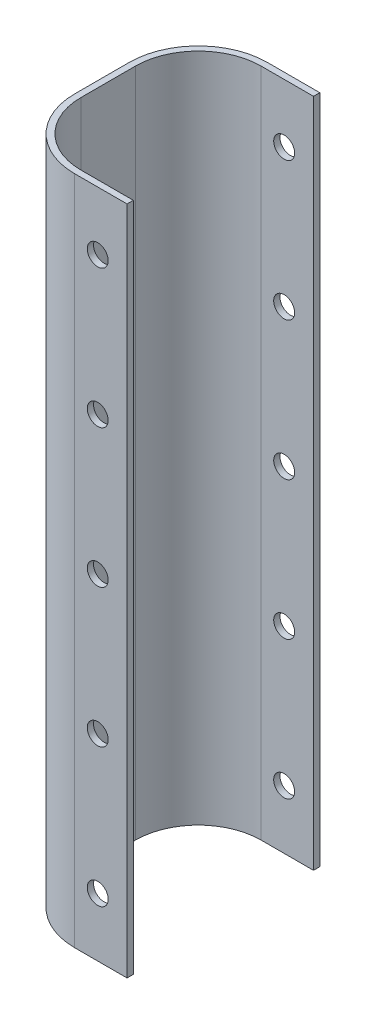
from build123d import *

# Parameters (mm, degrees)
EXTRUDE_2_DEPTH     = 160
SKETCH_5_R          = 2.5
CUT_EXTRUDE_1_DEPTH = 169.988165266


with BuildPart() as part:
    # Эскиз4 → Бобышка-Вытянуть2 (new body)
    with BuildSketch(Plane(origin=(0, 0, 0), x_dir=(1, 0, 0), z_dir=(0, 1, 0))):
        with BuildLine():
            Line((0, 0), (-12.5, 0))
            ThreePointArc((-12.5, 0), (-23.106601718, -4.393398282), (-27.5, -15))
            Line((-27.5, -15), (-27.5, -28))
            ThreePointArc((-27.5, -28), (-23.106601718, -38.606601718), (-12.5, -43))
            Line((-12.5, -43), (0, -43))
            Line((0, -43), (0, -44.5))
            Line((0, -44.5), (-12.5, -44.5))
            ThreePointArc((-12.5, -44.5), (-24.16726189, -39.66726189), (-29, -28))
            Line((-29, -28), (-29, -15))
            ThreePointArc((-29, -15), (-24.16726189, -3.33273811), (-12.5, 1.5))
            Line((-12.5, 1.5), (0, 1.5))
            Line((0, 1.5), (0, 0))
        make_face()
    extrude(amount=EXTRUDE_2_DEPTH)

    # Эскиз5 → Вырез-Вытянуть1 (cut, through all)
    with BuildSketch(Plane.XY.offset(44.5)):
        with Locations((-7, 80)):
            Circle(SKETCH_5_R)
        with Locations((-7, 47)):
            Circle(SKETCH_5_R)
        with Locations((-7, 14)):
            Circle(SKETCH_5_R)
        with Locations((-7, 146)):
            Circle(SKETCH_5_R)
        with Locations((-7, 113)):
            Circle(SKETCH_5_R)
    extrude(amount=-CUT_EXTRUDE_1_DEPTH, mode=Mode.SUBTRACT)


solid = part.part
